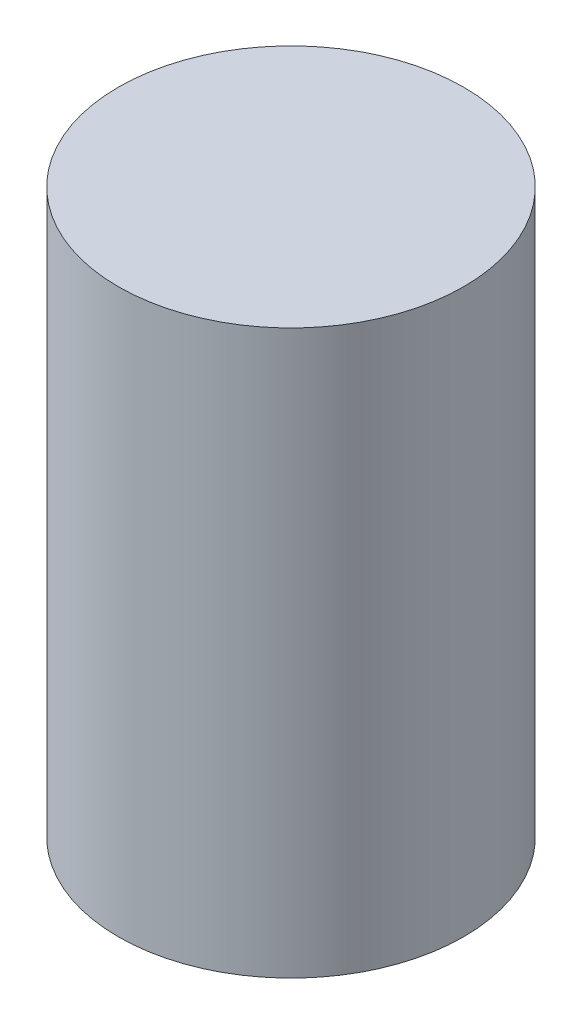
from build123d import *

# Parameters (mm, degrees)
SKETCH1_R           = 85.725
BOSS_EXTRUDE1_DEPTH = 279.4


with BuildPart() as part:
    # Sketch1 → Boss-Extrude1 (new body)
    with BuildSketch(Plane(origin=(0, 0, 0), x_dir=(1, 0, 0), z_dir=(0, 1, 0))):
        with Locations(Location((0, 0, 0), (0, 0, 270))):
            Circle(SKETCH1_R)
    extrude(amount=BOSS_EXTRUDE1_DEPTH)


solid = part.part
